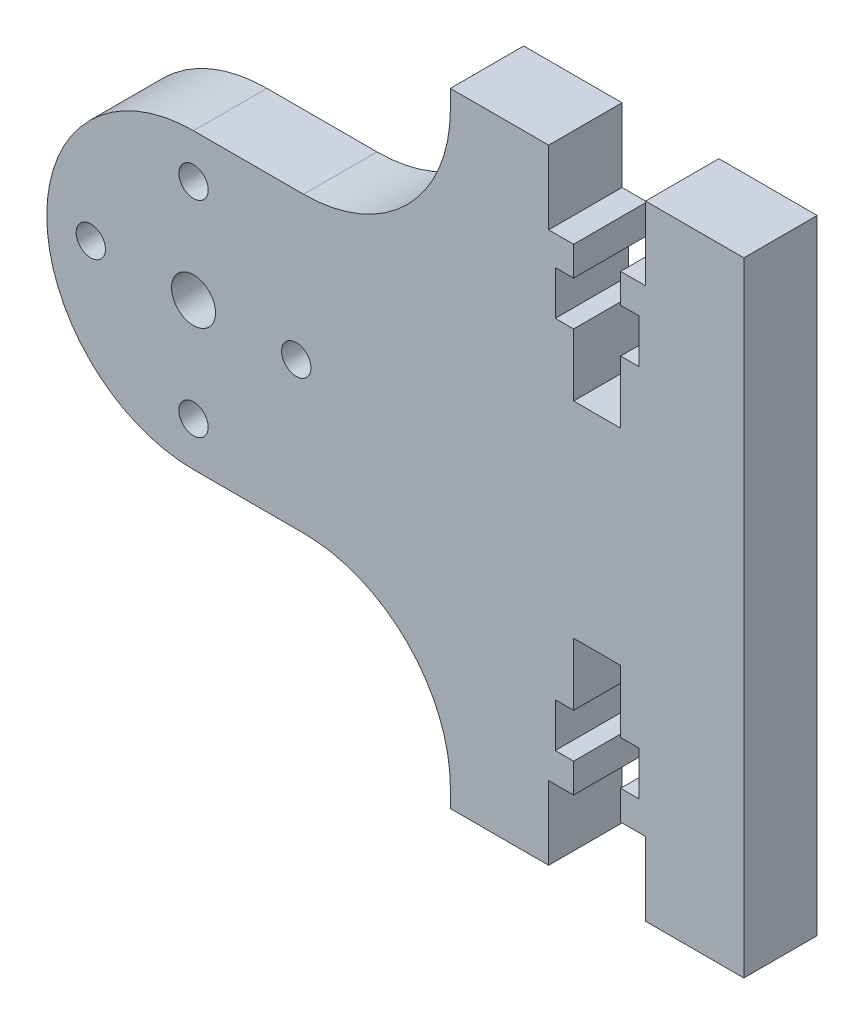
from build123d import *

# Parameters (mm, degrees)
BOSS_EXTRU_1_DEPTH = 5
ESQUISSE2_R        = 1.5
ESQUISSE2_R_2      = 1
BOSS_EXTRU_2_DEPTH = 5
CONG_1_R           = 10


with BuildPart() as part:
    # Esquisse1 → Boss.-Extru.1 (new body)
    with BuildSketch(Plane.XY):
        Polygon((-12.911051911, 37.825067336), (-12.911051911, -4.674932664), (-6.211051911, -4.674932664), (-6.211051911, 0.325067336), (-4.511051911, 0.325067336), (-4.511051911, 2.321763371), (-5.761051911, 2.321763371), (-5.761051911, 5.321763371), (-4.511051911, 5.321763371), (-4.511051911, 9.575067336), (-1.311051911, 9.575067336), (-1.311051911, 5.321763371), (-0.061051911, 5.321763371), (-0.061051911, 2.321763371), (-1.311051911, 2.321763371), (-1.311051911, 0.325067336), (0.388948089, 0.325067336), (0.388948089, -4.674932664), (7.088948089, -4.674932664), (7.088948089, 37.825067336), (0.388948089, 37.825067336), (0.388948089, 32.825067336), (-1.311051911, 32.825067336), (-1.311051911, 30.828371301), (-0.061051911, 30.828371301), (-0.061051911, 27.828371301), (-1.311051911, 27.828371301), (-1.311051911, 23.575067336), (-4.511051911, 23.575067336), (-4.511051911, 27.828371301), (-5.761051911, 27.828371301), (-5.761051911, 30.828371301), (-4.511051911, 30.828371301), (-4.511051911, 32.825067336), (-6.211051911, 32.825067336), (-6.211051911, 37.825067336), align=None)
    extrude(amount=BOSS_EXTRU_1_DEPTH)

    # Esquisse2 → Boss.-Extru.2 (add)
    with BuildSketch(Plane(origin=(0, 0, 0), x_dir=(-1, 0, 0), z_dir=(0, 0, -1))):
        with BuildLine():
            Line((30.411051911, 26.575067336), (12.911051911, 26.575067336))
            Line((12.911051911, 26.575067336), (12.911051911, 6.575067336))
            Line((12.911051911, 6.575067336), (30.411051911, 6.575067336))
            ThreePointArc((30.411051911, 6.575067336), (40.411051911, 16.575067336), (30.411051911, 26.575067336))
        make_face()
        with Locations((30.411051911, 16.575067336)):
            Circle(ESQUISSE2_R, mode=Mode.SUBTRACT)
        with Locations((30.411051911, 23.575067336)):
            Circle(ESQUISSE2_R_2, mode=Mode.SUBTRACT)
        with Locations((23.411051911, 16.575067336)):
            Circle(ESQUISSE2_R_2, mode=Mode.SUBTRACT)
        with Locations((30.411051911, 9.575067336)):
            Circle(ESQUISSE2_R_2, mode=Mode.SUBTRACT)
        with Locations((37.411051911, 16.575067336)):
            Circle(ESQUISSE2_R_2, mode=Mode.SUBTRACT)
    extrude(amount=-BOSS_EXTRU_2_DEPTH)

    # Congé1
    cong_1_edges = [part.edges().sort_by_distance(p)[0] for p in [
        (-12.911051911, 26.575067336, 2.5),
        (-12.911051911, 6.575067336, 2.5),
    ]]
    fillet(cong_1_edges, radius=CONG_1_R)


solid = part.part
